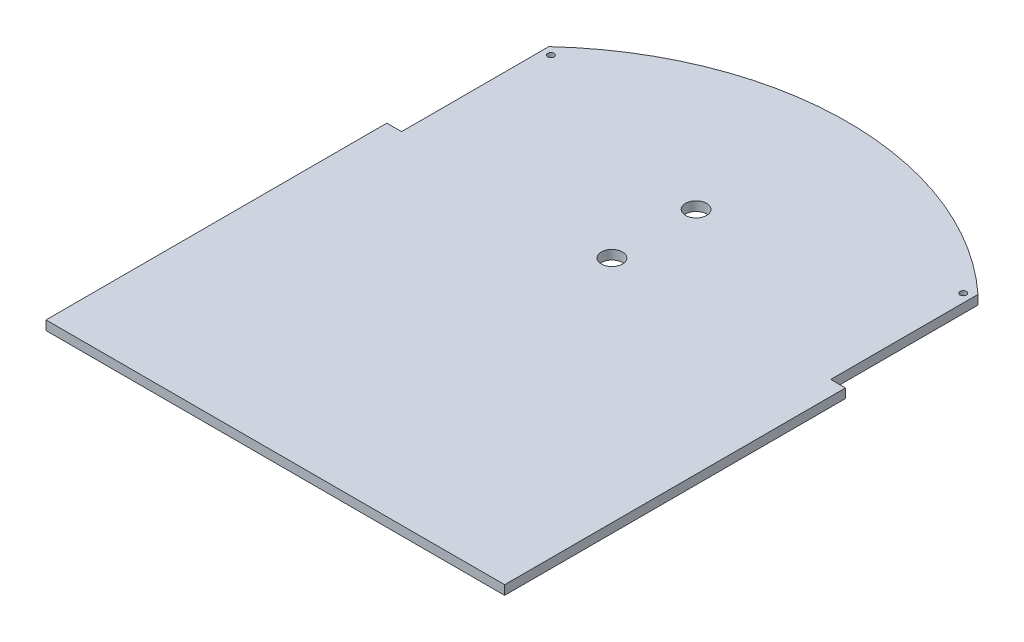
from build123d import *

# Parameters (mm, degrees)
BOSS_EXTRUDE1_DEPTH = 2.2
SKETCH2_R           = 0.75
SKETCH2_R_2         = 2.5
CUT_EXTRUDE1_DEPTH  = 10


with BuildPart() as part:
    # Sketch1 → Boss-Extrude1 (new body)
    with BuildSketch(Plane(origin=(0, 0, 0), x_dir=(1, 0, 0), z_dir=(0, 1, 0))):
        with BuildLine():
            Line((-54.5, 0), (-54.5, 81))
            Line((-54.5, 81), (-51, 81))
            Line((-51, 81), (-51, 116))
            ThreePointArc((-51, 116), (0, 136), (51, 116))
            Line((51, 116), (51, 81))
            Line((51, 81), (54.5, 81))
            Line((54.5, 81), (54.5, 0))
            Line((54.5, 0), (-54.5, 0))
        make_face()
    extrude(amount=BOSS_EXTRUDE1_DEPTH)

    # Sketch2 → Cut-Extrude1 (cut)
    with BuildSketch(Plane(origin=(0, 2.2, 0), x_dir=(1, 0, 0), z_dir=(0, 1, 0))):
        with Locations(Location((-49, 114.5, 0), (0, 0, 270))):
            Circle(SKETCH2_R)
        with Locations(Location((0, 100, 0), (0, 0, 270))):
            Circle(SKETCH2_R_2)
        with Locations(Location((0, 80, 0), (0, 0, 270))):
            Circle(SKETCH2_R_2)
    cut_extrude1 = extrude(amount=-CUT_EXTRUDE1_DEPTH, mode=Mode.SUBTRACT)

    # Mirror1: Cut-Extrude1 across plane
    add(cut_extrude1.mirror(Plane(origin=(0, 0, 0), x_dir=(0, 0, 1), z_dir=(1, 0, 0))), mode=Mode.SUBTRACT)


solid = part.part
